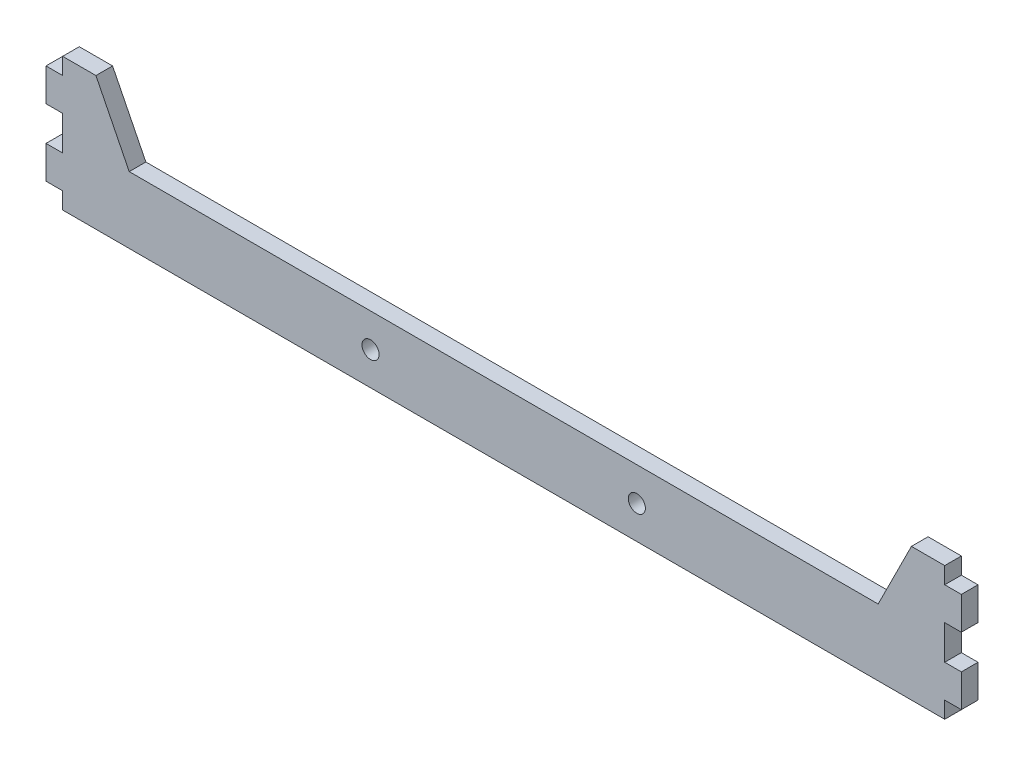
from build123d import *

# Parameters (mm, degrees)
BOSS_EXTRUDE1_DEPTH      = 6.35
F_0_257_DIAMETER_HOLE1_D = 6.5278


with BuildPart() as part:
    # Sketch1 → Boss-Extrude1 (new body)
    with BuildSketch(Plane.XY):
        Polygon((-168.275, -6.35), (-168.275, -12.7), (-142.875, -12.7), (-9.525, -12.7), (9.525, -12.7), (142.875, -12.7), (168.275, -12.7), (168.275, -6.35), (174.625, -6.35), (174.625, 6.15), (168.275, 6.15), (168.275, 12.7), (168.275, 19.25), (174.625, 19.25), (174.625, 31.75), (168.275, 31.75), (168.275, 38.1), (155.575, 38.1), (142.875, 12.7), (9.525, 12.7), (-9.525, 12.7), (-142.875, 12.7), (-155.575, 38.1), (-168.275, 38.1), (-168.275, 31.75), (-174.625, 31.75), (-174.625, 19.25), (-168.275, 19.25), (-168.275, 12.7), (-168.275, 6.15), (-174.625, 6.15), (-174.625, -6.35), align=None)
    extrude(amount=BOSS_EXTRUDE1_DEPTH)

    # F (0.257) Diameter Hole1 (through all)
    with Locations(Plane.XY.offset(6.35)):
        with Locations((-50.8, -0.1), (50.8, -0.1)):
            Hole(F_0_257_DIAMETER_HOLE1_D / 2)


solid = part.part
